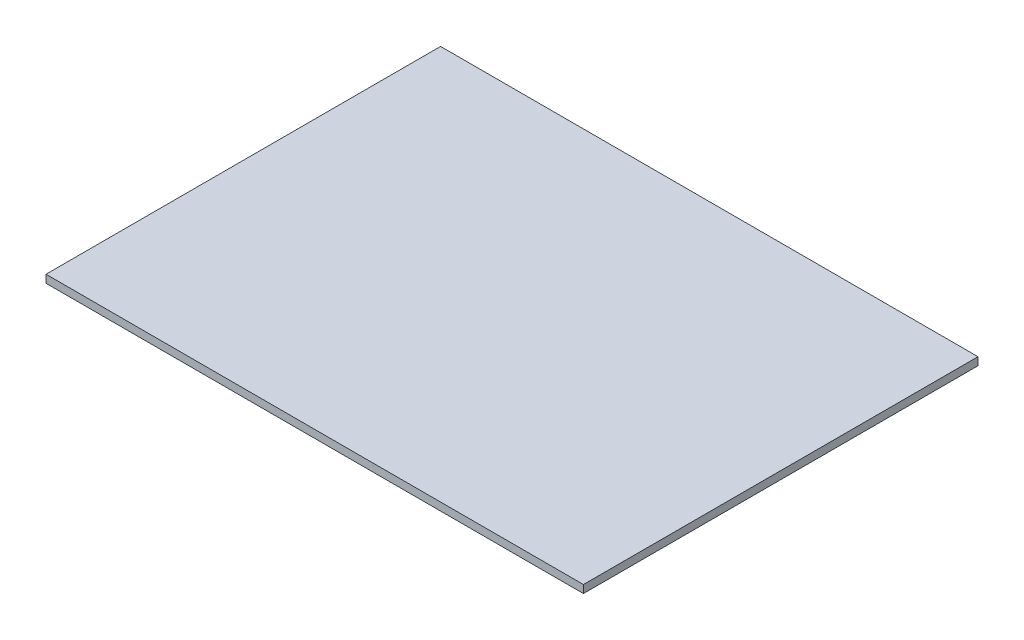
from build123d import *

# Parameters (mm, degrees)
SKETCH1_W           = 173.8
SKETCH1_H           = 127.6
BOSS_EXTRUDE1_DEPTH = 2.54


with BuildPart() as part:
    # Sketch1 → Boss-Extrude1 (new body)
    with BuildSketch(Plane(origin=(0, 0, 0), x_dir=(1, 0, 0), z_dir=(0, 1, 0))):
        with Locations((86.9, 63.8)):
            Rectangle(SKETCH1_W, SKETCH1_H)
    extrude(amount=BOSS_EXTRUDE1_DEPTH)


solid = part.part
